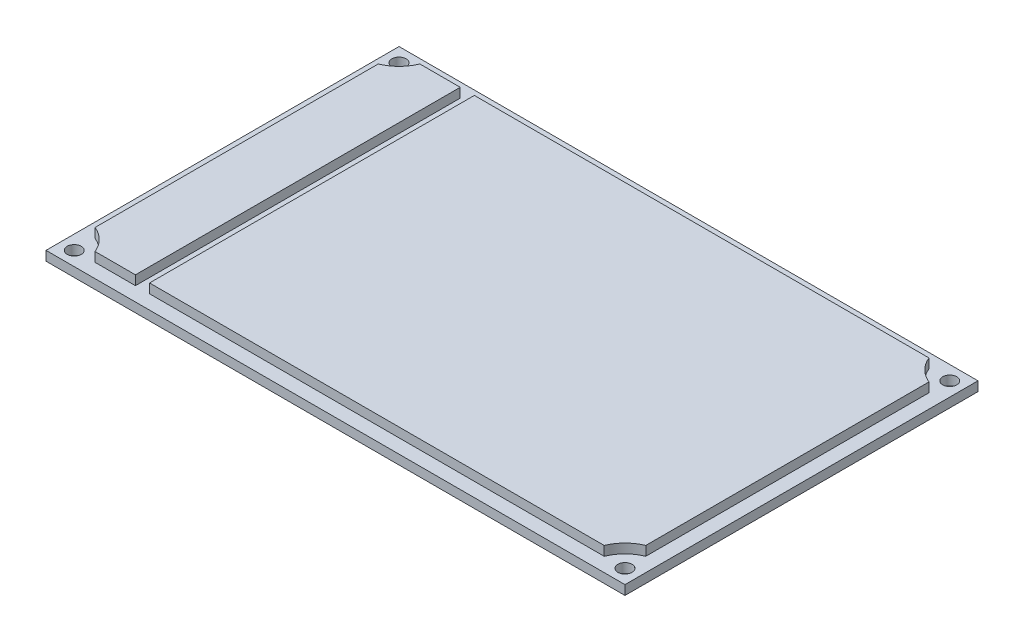
from build123d import *

# Parameters (mm, degrees)
EXTRUDE_1_DEPTH     = 2
EXTRUDE_2_DEPTH     = 2
SKETCH_1_5_W        = 123
SKETCH_1_5_H        = 75
EXTRUDE_3_DEPTH     = 2
SKETCH_1_6_R        = 1.5
CUT_EXTRUDE_1_DEPTH = 12


with BuildPart() as part:
    # Эскиз1 → Бобышка-Вытянуть1 (new body)
    with BuildSketch(Plane(origin=(0, 0, 0), x_dir=(1, 0, 0), z_dir=(0, 1, 0))):
        with BuildLine():
            Line((-46.710495983, 35.042327972), (-55.294297496, 35.042327972))
            ThreePointArc((-55.294297496, 35.042327972), (-57.053641733, 32.385473722), (-59.710495983, 30.626129484))
            Line((-59.710495983, 30.626129484), (-59.710495983, -29.541473541))
            ThreePointArc((-59.710495983, -29.541473541), (-57.053641733, -31.300817779), (-55.294297496, -33.957672028))
            Line((-55.294297496, -33.957672028), (-46.710495983, -33.957672028))
            Line((-46.710495983, -33.957672028), (-46.710495983, 35.042327972))
        make_face()
    extrude(amount=EXTRUDE_1_DEPTH)



with BuildPart() as body_2:
    # Эскиз1<4> → Бобышка-Вытянуть2 (new body)
    with BuildSketch(Plane(origin=(0, 0, 0), x_dir=(1, 0, 0), z_dir=(0, 1, 0))):
        with BuildLine():
            Line((-43.710495983, 35.042327972), (52.87330553, 35.042327972))
            ThreePointArc((52.87330553, 35.042327972), (54.632649768, 32.385473722), (57.289504017, 30.626129484))
            Line((57.289504017, 30.626129484), (57.289504017, -29.541473541))
            ThreePointArc((57.289504017, -29.541473541), (54.632649768, -31.300817779), (52.87330553, -33.957672028))
            Line((52.87330553, -33.957672028), (-43.710495983, -33.957672028))
            Line((-43.710495983, -33.957672028), (-43.710495983, 35.042327972))
        make_face()
    extrude(amount=EXTRUDE_2_DEPTH)


with BuildPart() as part_1:
    add(part.part)

    add(body_2.part)  # Бобышка-Вытянуть3 merges body 2
    # Эскиз1<5> → Бобышка-Вытянуть3 (add)
    with BuildSketch(Plane(origin=(0, 0, 0), x_dir=(1, 0, 0), z_dir=(0, 1, 0))):
        with Locations((-1.210495983, 0.542327972)):
            Rectangle(SKETCH_1_5_W, SKETCH_1_5_H)
    extrude(amount=-EXTRUDE_3_DEPTH)

    # Эскиз1<6> → Вырез-Вытянуть1 (cut)
    with BuildSketch(Plane(origin=(0, 0, 0), x_dir=(1, 0, 0), z_dir=(0, 1, 0))):
        with Locations((-59.710495983, 35.042327972)):
            Circle(SKETCH_1_6_R)
        with Locations((-59.710495983, -33.957672028)):
            Circle(SKETCH_1_6_R)
        with Locations((57.289504017, -33.957672028)):
            Circle(SKETCH_1_6_R)
        with Locations((57.289504017, 35.042327972)):
            Circle(SKETCH_1_6_R)
    extrude(amount=-CUT_EXTRUDE_1_DEPTH, mode=Mode.SUBTRACT)


solid = part_1.part
